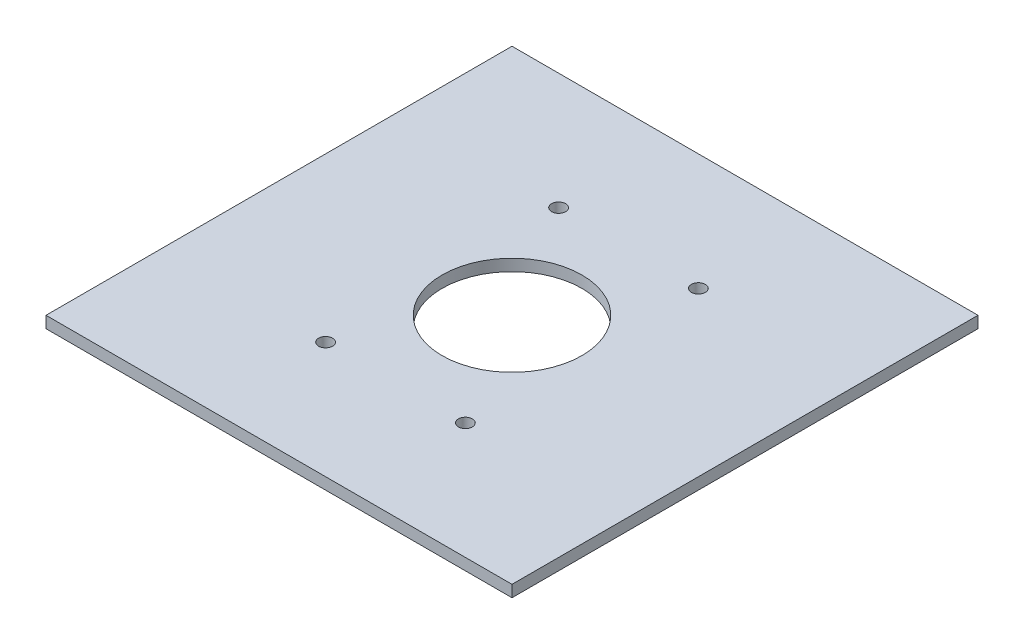
from build123d import *

# Parameters (mm, degrees)
SKETCH1_W           = 127
SKETCH1_H           = 127
BOSS_EXTRUDE1_DEPTH = 3.175
SKETCH2_R           = 19.05
SKETCH2_R_2         = 1.905
CUT_EXTRUDE1_DEPTH  = 90.858670283


with BuildPart() as part:
    # Sketch1 → Boss-Extrude1 (new body)
    with BuildSketch(Plane(origin=(0, 0, 0), x_dir=(1, 0, 0), z_dir=(0, 1, 0))):
        Rectangle(SKETCH1_W, SKETCH1_H)
    extrude(amount=BOSS_EXTRUDE1_DEPTH)

    # Sketch2 → Cut-Extrude1 (cut, through all)
    with BuildSketch(Plane(origin=(0, 0, 0), x_dir=(1, 0, 0), z_dir=(0, 1, 0))):
        with Locations(Location((0, 0, 0), (0, 0, 270))):
            Circle(SKETCH2_R)
        with Locations(Location((19.05, 31.75, 0), (0, 0, 270))):
            Circle(SKETCH2_R_2)
        with Locations(Location((-19.05, 31.75, 0), (0, 0, 270))):
            Circle(SKETCH2_R_2)
        with Locations(Location((-19.05, -31.75, 0), (0, 0, 270))):
            Circle(SKETCH2_R_2)
        with Locations(Location((19.05, -31.75, 0), (0, 0, 270))):
            Circle(SKETCH2_R_2)
    extrude(amount=CUT_EXTRUDE1_DEPTH, mode=Mode.SUBTRACT)


solid = part.part
